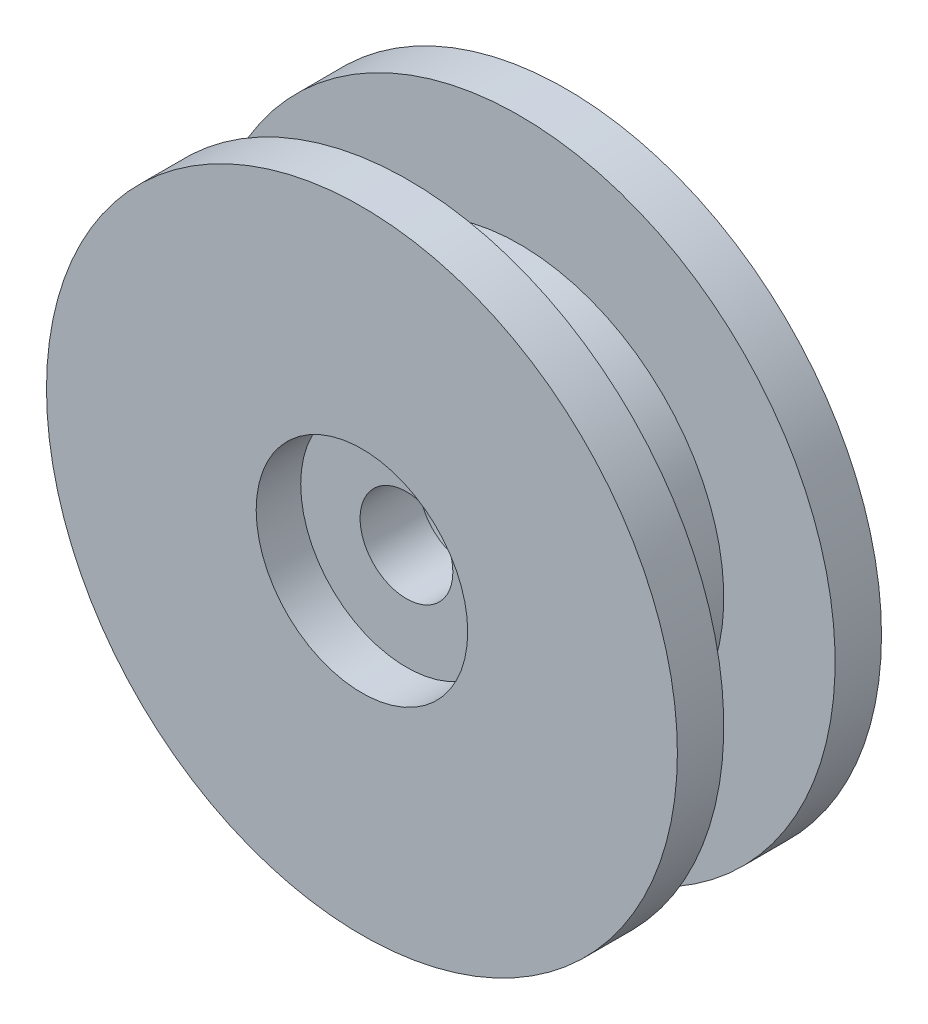
from build123d import *

# Parameters (mm, degrees)
CROQUIS1_R              = 8.5
SALIENTE_EXTRUIR1_DEPTH = 5.5
CROQUIS3_R              = 2.85
CORTAR_EXTRUIR1_DEPTH   = 1.2
CROQUIS4_R              = 1.25
CORTAR_EXTRUIR2_DEPTH   = 14.219304066
CROQUIS5_R              = 2.32
CORTAR_EXTRUIR3_DEPTH   = 2.7


with BuildPart() as part:
    # Croquis1 → Saliente-Extruir1 (new body)
    with BuildSketch(Plane.XY):
        Circle(CROQUIS1_R)
    extrude(amount=SALIENTE_EXTRUIR1_DEPTH)

    # Croquis2 → Cortar-Revolución1 (revolve, cut)
    with BuildSketch(Plane(origin=(0, 0, 0), x_dir=(0, 0, -1), z_dir=(1, 0, 0)), mode=Mode.PRIVATE) as cortar_revoluci_n1_sk:
        Polygon((-5.5, 8.5), (-4.25, 8.5), (-4.25, 5.5), (-1.25, 5.5), (-1.25, 8.5), (0, 8.5), (0, 8.952172256), (-5.5, 8.952172256), align=None)
    revolve(cortar_revoluci_n1_sk.sketch.rotate(Axis((0, 0, 0), (0, 0, 1)), 90), axis=Axis((0, 0, 0), (0, 0, 1)), mode=Mode.SUBTRACT)

    # Croquis3 → Cortar-Extruir1 (cut)
    with BuildSketch(Plane.XY.offset(5.5)):
        Circle(CROQUIS3_R)
    extrude(amount=-CORTAR_EXTRUIR1_DEPTH, mode=Mode.SUBTRACT)

    # Croquis4 → Cortar-Extruir2 (cut, through all)
    with BuildSketch(Plane.XY.offset(5.5)):
        Circle(CROQUIS4_R)
    extrude(amount=-CORTAR_EXTRUIR2_DEPTH, mode=Mode.SUBTRACT)

    # Croquis5 → Cortar-Extruir3 (cut)
    with BuildSketch(Plane(origin=(0, 0, 0), x_dir=(-1, 0, 0), z_dir=(0, 0, -1))):
        Circle(CROQUIS5_R)
    extrude(amount=-CORTAR_EXTRUIR3_DEPTH, mode=Mode.SUBTRACT)


solid = part.part
